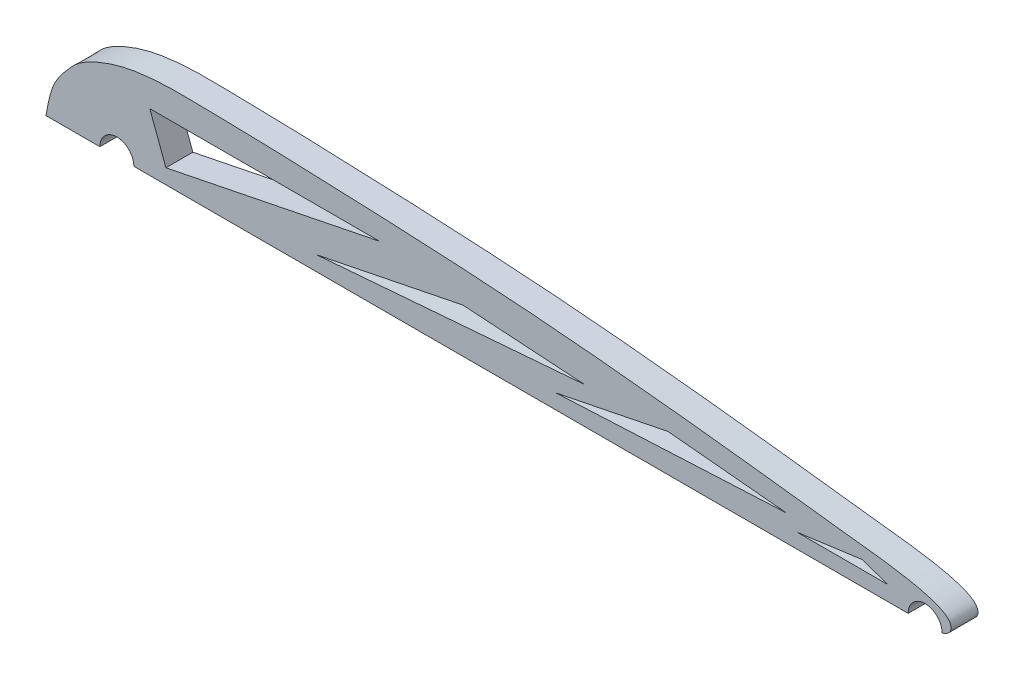
from build123d import *

# Parameters (mm, degrees)
EXTRUDE_1_DEPTH = 5


with BuildPart() as part:
    # 草圖1 → 填料-伸長1 (new body)
    with BuildSketch(Plane.XY):
        with BuildLine():
            Line((-88.15, 0), (-78.15, 0))
            ThreePointArc((-78.15, 0), (-75, 3.15), (-71.85, 0))
            Line((-71.85, 0), (71.85, 0))
            ThreePointArc((71.85, 0), (75, 3.15), (78.15, 0))
            add(Edge.make_bspline(
                [(-88.15, 0), (-87.220002266, 5.738359665), (-86.162585035, 7.095257959), (-81.599345249, 12.267454727), (-75.949273601, 14.615150152), (-66.899781039, 16.243325152), (-61.139680353, 15.879138132), (-48.135127968, 15.769425726), (-10.427933288, 14.348272569), (10.492508658, 12.610172136), (40.20829084, 9.573899213), (42.969757718, 9.069995754), (64.990617126, 6.470036457), (81.323719988, 4.873843593), (79.728820358, 0.427224178), (78.15, 0)],
                knots=[0, 0, 0, 0, 0.103555286, 0.121162723, 0.169973071, 0.187492296, 0.278835752, 0.301421395, 0.40193079, 0.5100059, 0.54348357, 0.715238164, 0.759475411, 0.941618795, 1, 1, 1, 1], degree=3))
        make_face()
        Polygon((-68.893522957, 10.759830703), (-65.899618401, 2.742883445), (-26.230383037, 10.759830703), align=None, mode=Mode.SUBTRACT)
        Polygon((-37.956509213, 2.742883445), (-10.786214777, 8.233859399), (11.817154027, 6.751357074), align=None, mode=Mode.SUBTRACT)
        Polygon((6.453075031, 2.742883445), (27.266243577, 6.949117142), (49.240960974, 4.846000293), align=None, mode=Mode.SUBTRACT)
        Polygon((51.268635043, 2.742883445), (63.297609004, 4.38617694), (68.109198588, 2.742883445), align=None, mode=Mode.SUBTRACT)
    extrude(amount=EXTRUDE_1_DEPTH)


solid = part.part
